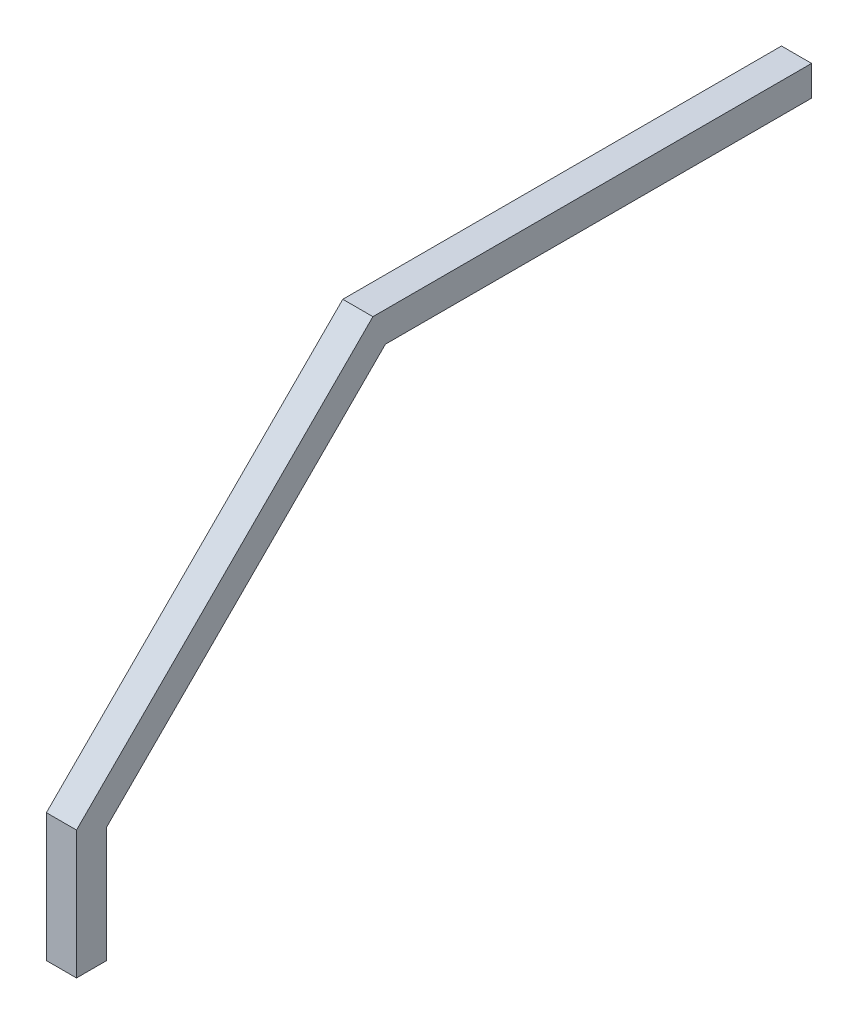
from build123d import *

# Parameters (mm, degrees)
BOSS_EXTRUDE1_DEPTH = 25.4


with BuildPart() as part:
    # Sketch1 → Boss-Extrude1 (new body)
    with BuildSketch(Plane(origin=(0, 0, 0), x_dir=(0, 0, -1), z_dir=(1, 0, 0))):
        Polygon((0, 450), (250, 700), (620, 700), (620, 674.6), (260.521024484, 674.6), (25.4, 439.478975516), (25.4, 341.93505653), (0, 341.93505653), align=None)
    extrude(amount=BOSS_EXTRUDE1_DEPTH)


solid = part.part
